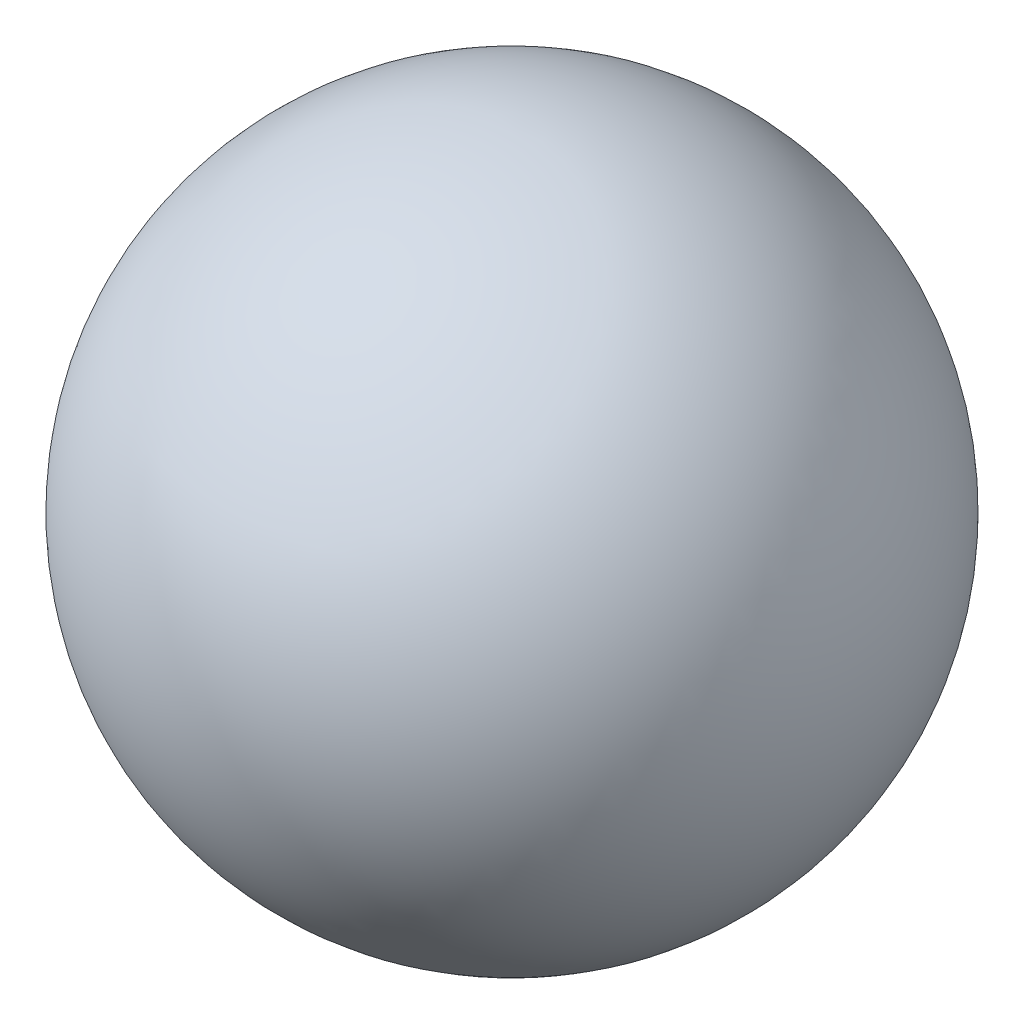
from build123d import *

# Parameters (mm, degrees)
SKETCH3_R          = 6
CUT_EXTRUDE1_DEPTH = 25


with BuildPart() as part:
    # Sketch2 → Revolve1 (revolve)
    with BuildSketch(Plane.XY):
        with BuildLine():
            Line((0, -20), (0, 20))
            ThreePointArc((0, 20), (20, 0), (0, -20))
        make_face()
    revolve(axis=Axis((0, -20, 0), (0, 1, 0)))

    # Sketch3 → Cut-Extrude1 (cut)
    with BuildSketch(Plane(origin=(0, 0, 0), x_dir=(1, 0, 0), z_dir=(0, 1, 0))):
        with Locations(Location((0, 0, 0), (0, 0, 270))):
            Circle(SKETCH3_R)
    extrude(amount=-CUT_EXTRUDE1_DEPTH, mode=Mode.SUBTRACT)


solid = part.part
